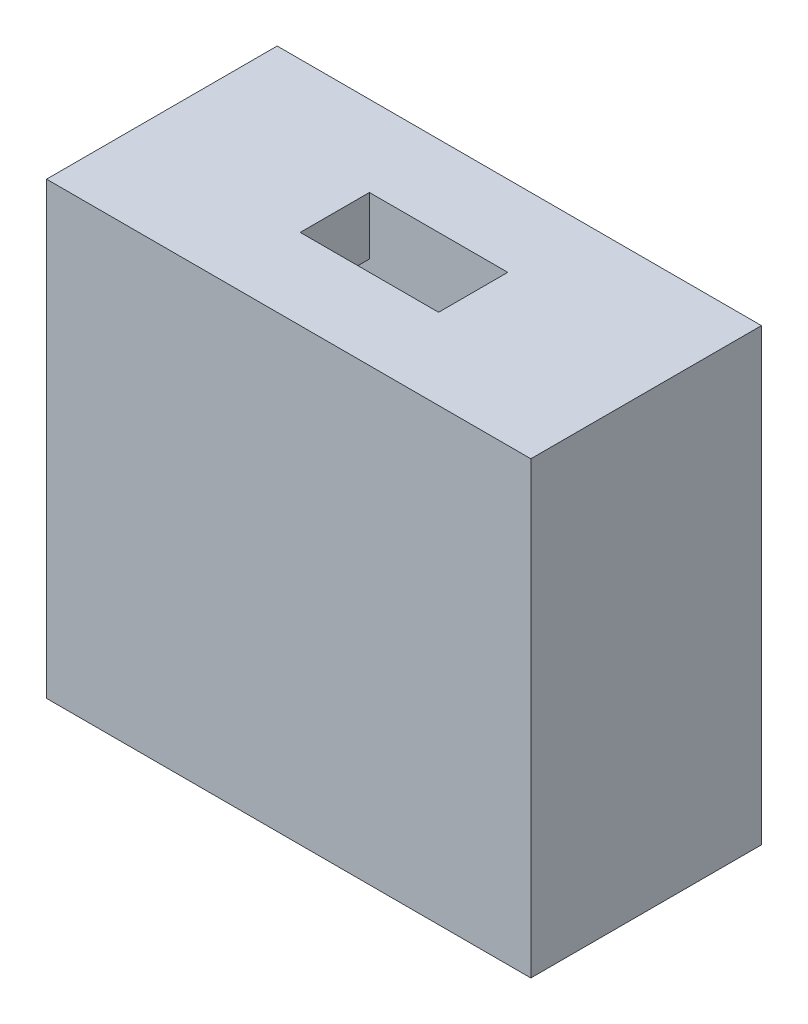
from build123d import *

# Parameters (mm, degrees)
ESQUISSE1_W             = 42
ESQUISSE1_H             = 20
BOSS_EXTRU_1_DEPTH      = 39
ESQUISSE2_W             = 12
ESQUISSE2_H             = 6
ENL_V_MAT_EXTRU_1_DEPTH = 10
ESQUISSE3_W             = 6
ESQUISSE3_H             = 5
ENL_V_MAT_EXTRU_2_DEPTH = 49.476798574


with BuildPart() as part:
    # Esquisse1 → Boss.-Extru.1 (new body)
    with BuildSketch(Plane(origin=(0, 0, 0), x_dir=(1, 0, 0), z_dir=(0, 1, 0))):
        Rectangle(ESQUISSE1_W, ESQUISSE1_H)
    extrude(amount=BOSS_EXTRU_1_DEPTH)

    # Esquisse2 → Enlèv. mat.-Extru.1 (cut)
    with BuildSketch(Plane(origin=(0, 39, 0), x_dir=(1, 0, 0), z_dir=(0, 1, 0))):
        Rectangle(ESQUISSE2_W, ESQUISSE2_H)
    extrude(amount=-ENL_V_MAT_EXTRU_1_DEPTH, mode=Mode.SUBTRACT)

    # Esquisse3 → Enlèv. mat.-Extru.2 (cut, through all)
    with BuildSketch(Plane(origin=(-6, 0, 0), x_dir=(0, 0, -1), z_dir=(1, 0, 0))):
        with Locations((0, 31.5)):
            Rectangle(ESQUISSE3_W, ESQUISSE3_H)
    extrude(amount=-ENL_V_MAT_EXTRU_2_DEPTH, mode=Mode.SUBTRACT)


solid = part.part
